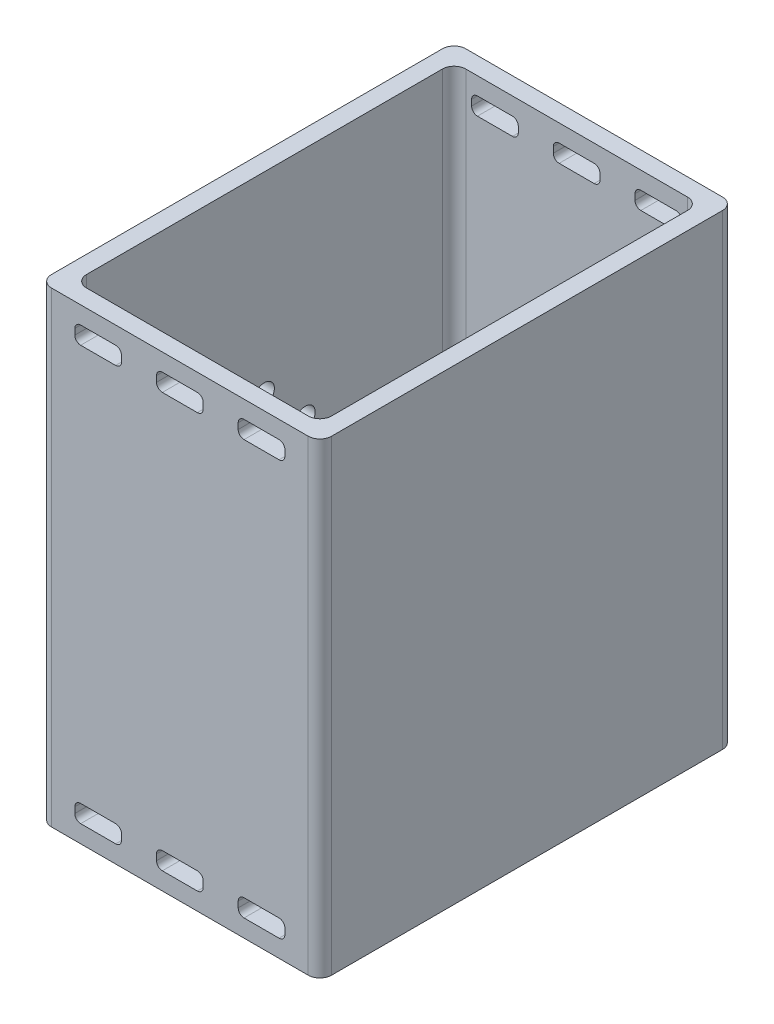
from build123d import *

# Parameters (mm, degrees)
SKETCH1_W                = 48
SKETCH1_H                = 71
SKETCH1_W_2              = 42
SKETCH1_H_2              = 65
BOSS_EXTRUDE1_DEPTH      = 80
M3_CLEARANCE_HOLE1_D     = 3.4
M3_CLEARANCE_HOLE1_DEPTH = 3
SKETCH5_W                = 8
SKETCH5_H                = 3
CUT_EXTRUDE1_DEPTH       = 110.622078068
FILLET1_R                = 2
FILLET2_R                = 1


with BuildPart() as part:
    # Sketch1 → Boss-Extrude1 (new body)
    with BuildSketch(Plane(origin=(0, 0, 0), x_dir=(1, 0, 0), z_dir=(0, 1, 0))):
        Rectangle(SKETCH1_W, SKETCH1_H)
        Rectangle(SKETCH1_W_2, SKETCH1_H_2, mode=Mode.SUBTRACT)
    extrude(amount=BOSS_EXTRUDE1_DEPTH)

    # M3 Clearance Hole1
    with Locations(Plane(origin=(-21, 0, 0), x_dir=(0, 0, -1), z_dir=(1, 0, 0))):
        with Locations((0, 40), (0, 47), (7, 40), (0, 33), (-7, 40)):
            Hole(M3_CLEARANCE_HOLE1_D / 2, depth=M3_CLEARANCE_HOLE1_DEPTH)

    # Sketch5 → Cut-Extrude1 (cut, through all)
    with BuildSketch(Plane.XY.offset(35.5)):
        with Locations((0, 4.5)):
            Rectangle(SKETCH5_W, SKETCH5_H)
        with Locations((0, 75.5)):
            Rectangle(SKETCH5_W, SKETCH5_H)
        with Locations((14, 4.5)):
            Rectangle(SKETCH5_W, SKETCH5_H)
        with Locations((-14, 4.5)):
            Rectangle(SKETCH5_W, SKETCH5_H)
        with Locations((-14, 75.5)):
            Rectangle(SKETCH5_W, SKETCH5_H)
        with Locations((14, 75.5)):
            Rectangle(SKETCH5_W, SKETCH5_H)
    extrude(amount=-CUT_EXTRUDE1_DEPTH, mode=Mode.SUBTRACT)

    # Fillet1
    fillet1_edges = [part.edges().sort_by_distance(p)[0] for p in [
        (21, 40, 32.5),
        (21, 40, -32.5),
        (-21, 40, -32.5),
        (-21, 40, 32.5),
        (-24, 40, -35.5),
        (24, 40, -35.5),
        (24, 40, 35.5),
        (-24, 40, 35.5),
    ]]
    fillet(fillet1_edges, radius=FILLET1_R)

    # Fillet2
    fillet2_edges = [part.edges().sort_by_distance(p)[0] for p in [
        (-4, 74, -34),
        (-4, 77, -34),
        (4, 77, -34),
        (4, 74, -34),
        (-4, 74, 34),
        (-4, 77, 34),
        (4, 77, 34),
        (4, 74, 34),
        (18, 6, -34),
        (18, 3, -34),
        (10, 3, -34),
        (10, 6, -34),
        (18, 6, 34),
        (18, 3, 34),
        (10, 3, 34),
        (10, 6, 34),
        (-10, 6, -34),
        (-10, 3, -34),
        (-18, 3, -34),
        (-18, 6, -34),
        (-10, 6, 34),
        (-10, 3, 34),
        (-18, 3, 34),
        (-18, 6, 34),
        (-18, 74, -34),
        (-18, 77, -34),
        (-10, 77, -34),
        (-10, 74, -34),
        (-18, 74, 34),
        (-18, 77, 34),
        (-10, 77, 34),
        (-10, 74, 34),
        (10, 74, -34),
        (10, 77, -34),
        (18, 77, -34),
        (18, 74, -34),
        (10, 74, 34),
        (10, 77, 34),
        (18, 77, 34),
        (18, 74, 34),
        (4, 6, -34),
        (4, 3, -34),
        (-4, 3, -34),
        (-4, 6, -34),
        (4, 6, 34),
        (4, 3, 34),
        (-4, 3, 34),
        (-4, 6, 34),
    ]]
    fillet(fillet2_edges, radius=FILLET2_R)


solid = part.part
